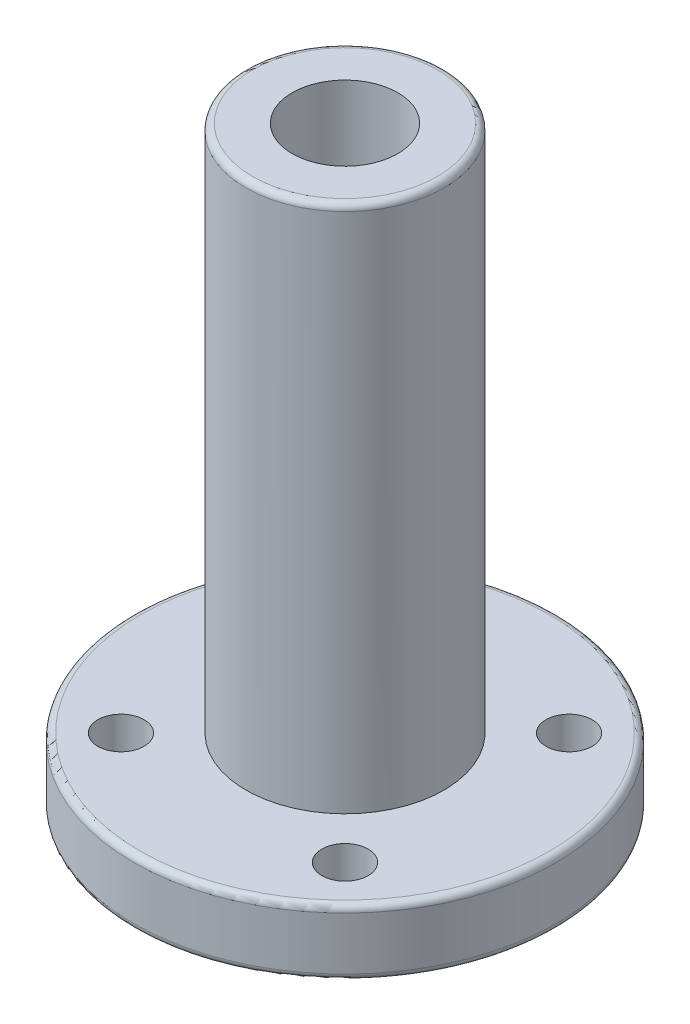
from build123d import *

# Parameters (mm, degrees)
SKETCH1_R           = 7.5
SKETCH1_R_2         = 4
BOSS_EXTRUDE1_DEPTH = 45
SKETCH2_R           = 16
SKETCH2_R_2         = 1.75
SKETCH2_R_3         = 7.5
BOSS_EXTRUDE2_DEPTH = 5
FILLET2_R           = 0.5


with BuildPart() as part:
    # Sketch1 → Boss-Extrude1 (new body)
    with BuildSketch(Plane(origin=(0, 0, 0), x_dir=(1, 0, 0), z_dir=(0, 1, 0))):
        with Locations(Location((0, 0, 0), (0, 0, 90))):
            Circle(SKETCH1_R)
        with Locations(Location((0, 0, 0), (0, 0, 90))):
            Circle(SKETCH1_R_2, mode=Mode.SUBTRACT)
    extrude(amount=BOSS_EXTRUDE1_DEPTH)

    # Sketch2 → Boss-Extrude2 (add)
    with BuildSketch(Plane.XZ):
        with Locations(Location((0, 0, 0), (0, 0, 270))):
            Circle(SKETCH2_R)
        with Locations(Location((8.485281374, 8.485281374, 0), (0, 0, 270))):
            Circle(SKETCH2_R_2, mode=Mode.SUBTRACT)
        with Locations(Location((0, 0, 0), (0, 0, 270))):
            Circle(SKETCH2_R_3, mode=Mode.SUBTRACT)
        with Locations(Location((-8.485281374, 8.485281374, 0), (0, 0, 90))):
            Circle(SKETCH2_R_2, mode=Mode.SUBTRACT)
        with Locations(Location((-8.485281374, -8.485281374, 0), (0, 0, 270))):
            Circle(SKETCH2_R_2, mode=Mode.SUBTRACT)
        with Locations(Location((8.485281374, -8.485281374, 0), (0, 0, 90))):
            Circle(SKETCH2_R_2, mode=Mode.SUBTRACT)
    extrude(amount=-BOSS_EXTRUDE2_DEPTH)

    # Fillet2
    fillet2_edges = [part.edges().sort_by_distance(p)[0] for p in [
        (0, 5, 16),
        (0, 0, 16),
        (0, 45, 7.5),
    ]]
    fillet(fillet2_edges, radius=FILLET2_R)


solid = part.part
